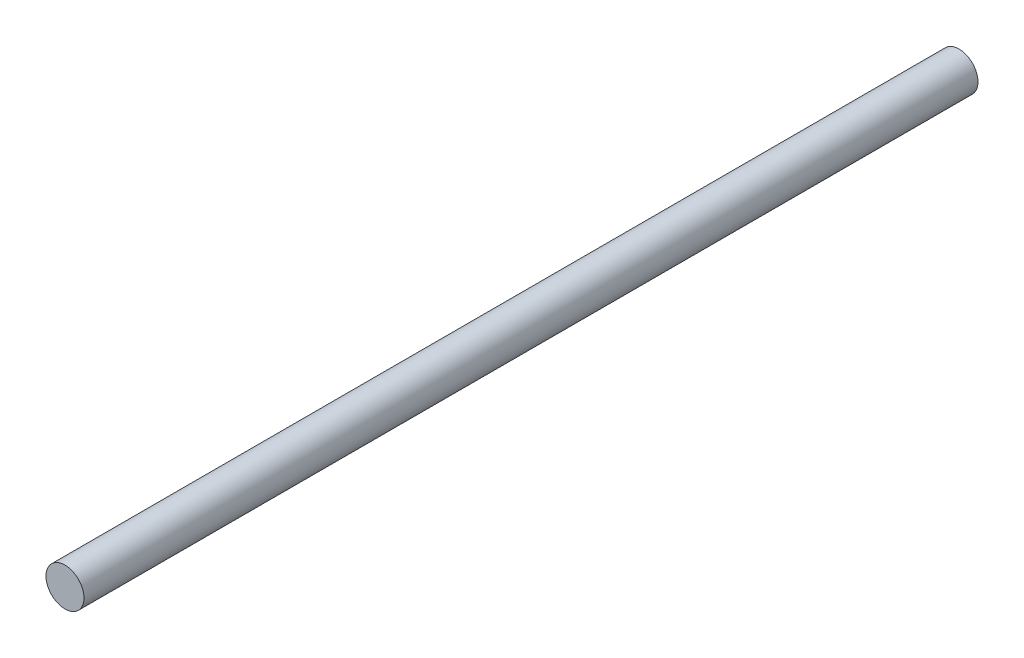
from build123d import *

# Parameters (mm, degrees)
SKETCH2_R           = 12.7
BOSS_EXTRUDE1_DEPTH = 596.9


with BuildPart() as part:
    # Sketch2 → Boss-Extrude1 (new body)
    with BuildSketch(Plane.XY):
        Circle(SKETCH2_R)
    extrude(amount=BOSS_EXTRUDE1_DEPTH)


solid = part.part
